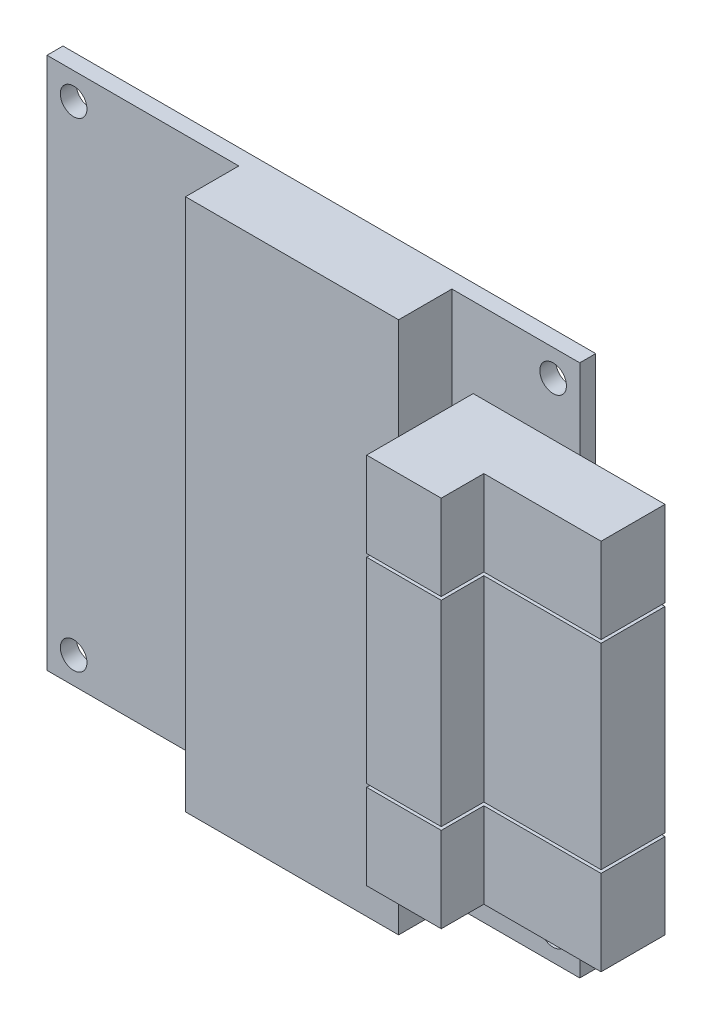
from build123d import *

# Parameters (mm, degrees)
SKETCH_1_W          = 50
SKETCH_1_H          = 50
EXTRUDE_1_DEPTH     = 1.5
SKETCH_2_W          = 20
SKETCH_2_H          = 50
EXTRUDE_2_DEPTH     = 5
SKETCH_3_W          = 18
SKETCH_3_H          = 8
SKETCH_3_H_2        = 18.4
EXTRUDE_3_DEPTH     = 10
SKETCH_4_W          = 11
SKETCH_4_H          = 4
CUT_EXTRUDE_1_DEPTH = 56.022722579
SKETCH_5_R          = 1.25
CUT_EXTRUDE_2_DEPTH = 43.591078878


with BuildPart() as part:
    # 草图1 → 凸台-拉伸1 (new body)
    with BuildSketch(Plane.XY):
        Rectangle(SKETCH_1_W, SKETCH_1_H)
    extrude(amount=EXTRUDE_1_DEPTH)

    # 草图2 → 凸台-拉伸2 (add)
    with BuildSketch(Plane.XY.offset(1.5)):
        with Locations((3, 0)):
            Rectangle(SKETCH_2_W, SKETCH_2_H)
    extrude(amount=EXTRUDE_2_DEPTH)

    # 草图3 → 凸台-拉伸3 (add)
    with BuildSketch(Plane.XY.offset(1.5)):
        with Locations((24, 13.5)):
            Rectangle(SKETCH_3_W, SKETCH_3_H)
        with Locations((24, 0)):
            Rectangle(SKETCH_3_W, SKETCH_3_H_2)
        with Locations((24, -13.5)):
            Rectangle(SKETCH_3_W, SKETCH_3_H)
    extrude(amount=EXTRUDE_3_DEPTH)

    # 草图4 → 切除-拉伸1 (cut, through all)
    with BuildSketch(Plane.XZ.offset(17.5)):
        with Locations((27.5, 9.5)):
            Rectangle(SKETCH_4_W, SKETCH_4_H)
    extrude(amount=-CUT_EXTRUDE_1_DEPTH, mode=Mode.SUBTRACT)

    # 草图5 → 切除-拉伸2 (cut, through all)
    with BuildSketch(Plane.XY.offset(1.5)):
        with Locations((-22.5, 22.5)):
            Circle(SKETCH_5_R)
        with Locations((22.5, 22.5)):
            Circle(SKETCH_5_R)
        with Locations((22.5, -22.5)):
            Circle(SKETCH_5_R)
        with Locations((-22.5, -22.5)):
            Circle(SKETCH_5_R)
    extrude(amount=-CUT_EXTRUDE_2_DEPTH, mode=Mode.SUBTRACT)


solid = part.part
